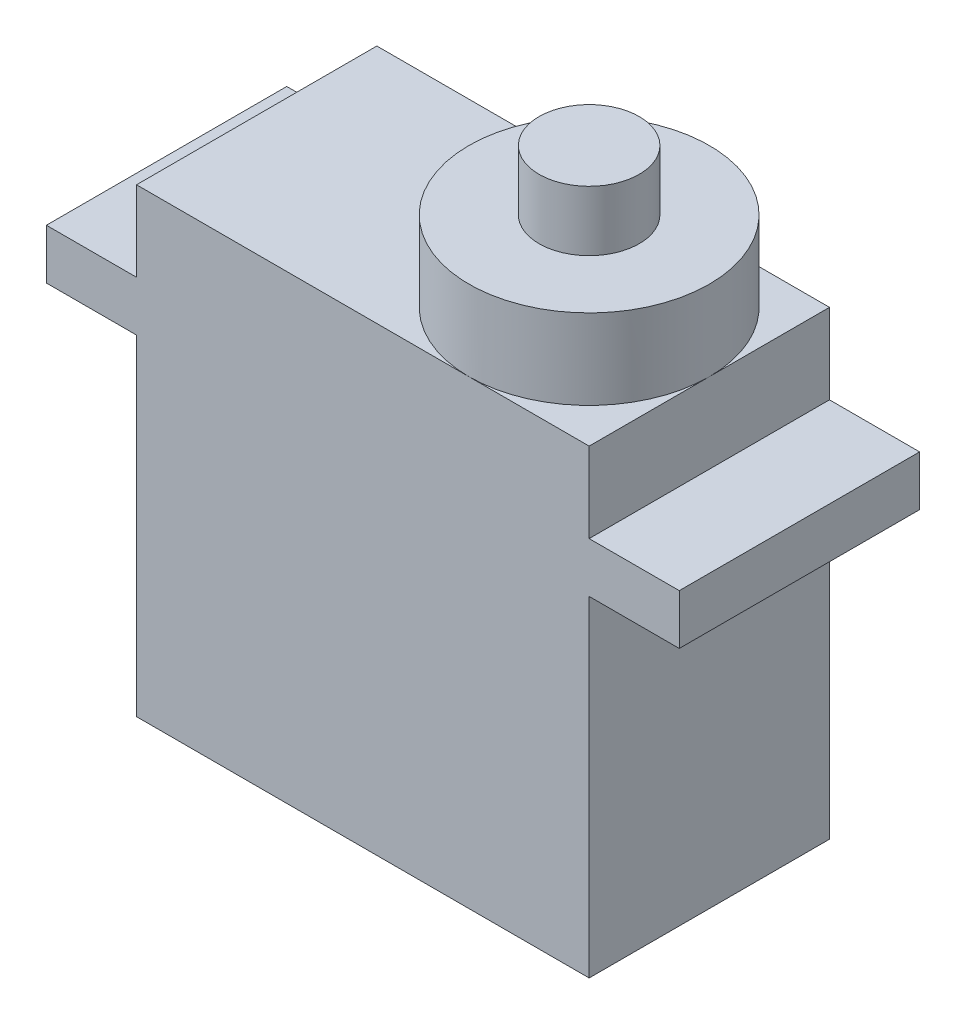
from build123d import *

# Parameters (mm, degrees)
BOSS_EXTRUDE1_DEPTH = 12
BOSS_EXTRUDE2_DEPTH = 4
SKETCH3_R           = 2.5
BOSS_EXTRUDE3_DEPTH = 3


with BuildPart() as part:
    # Sketch1 → Boss-Extrude1 (new body)
    with BuildSketch(Plane.XY):
        Polygon((0, 0), (0, 16.5), (4.5, 16.5), (4.5, 19), (0, 19), (0, 23), (-22.6, 23), (-22.6, 19), (-27.1, 19), (-27.1, 16.5), (-22.6, 16.5), (-22.6, 0), align=None)
    extrude(amount=BOSS_EXTRUDE1_DEPTH)

    # Sketch2 → Boss-Extrude2 (add)
    with BuildSketch(Plane(origin=(0, 23, 0), x_dir=(1, 0, 0), z_dir=(0, 1, 0))):
        with BuildLine():
            ThreePointArc((-6, 0), (-12, -6), (-6, -12))
            Line((-6, -12), (-6, 0))
        make_face()
        with BuildLine():
            Line((-6, 0), (-6, -12))
            ThreePointArc((-6, -12), (-1.757359313, -10.242640687), (0, -6))
            ThreePointArc((0, -6), (-1.757359313, -1.757359313), (-6, 0))
        make_face()
    extrude(amount=BOSS_EXTRUDE2_DEPTH)

    # Sketch3 → Boss-Extrude3 (add)
    with BuildSketch(Plane(origin=(0, 27, 0), x_dir=(1, 0, 0), z_dir=(0, 1, 0))):
        with Locations(Location((-6, -6, 0), (0, 0, 180))):
            Circle(SKETCH3_R)
    extrude(amount=BOSS_EXTRUDE3_DEPTH)


solid = part.part
